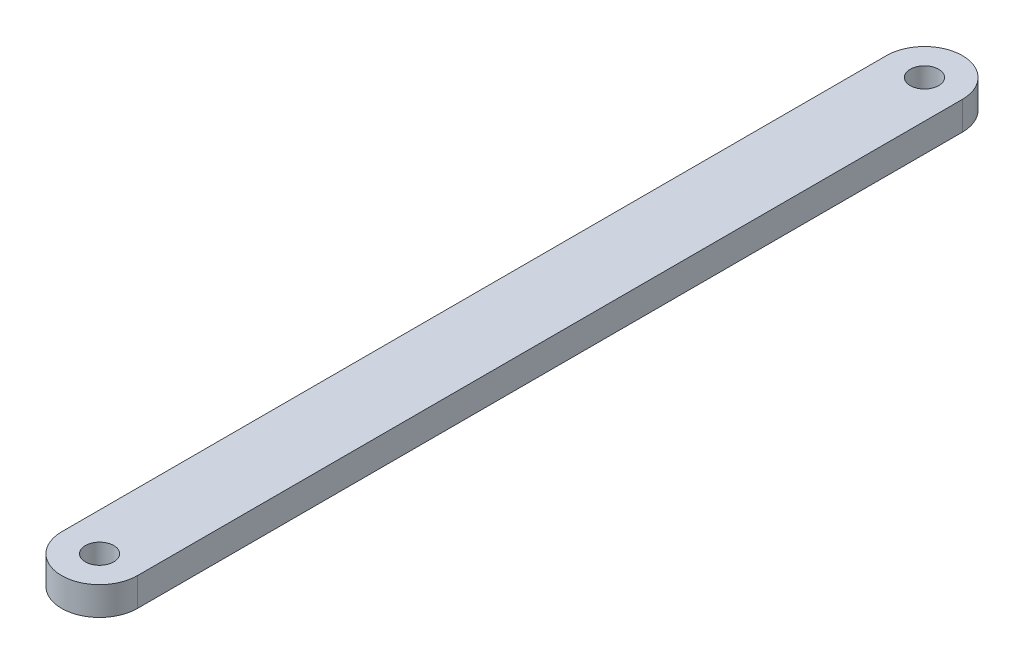
from build123d import *

# Parameters (mm, degrees)
CROQUIS1_R                 = 1.5
SALIENTE_EXTRUIR1_DEPTH    = 3
S_LIDO_MOVER_COPIAR1_ANGLE = 90


with BuildPart() as part:
    # Croquis1 → Saliente-Extruir1 (new body)
    with BuildSketch(Plane.XY):
        with BuildLine():
            Line((41840.173257962, -436.939495492), (41840.173257962, -351.939495492))
            ThreePointArc((41840.173257962, -351.939495492), (41836.173257962, -347.939495492), (41832.173257962, -351.939495492))
            Line((41832.173257962, -351.939495492), (41832.173257962, -436.939495492))
            Line((41832.173257962, -436.939495492), (41832.173257962, -438.939495492))
            ThreePointArc((41832.173257962, -438.939495492), (41836.173257962, -442.939495492), (41840.173257962, -438.939495492))
            Line((41840.173257962, -438.939495492), (41840.173257962, -436.939495492))
        make_face()
        with Locations((41836.173257962, -351.939495492)):
            Circle(CROQUIS1_R, mode=Mode.SUBTRACT)
        with Locations((41836.173257962, -438.939495492)):
            Circle(CROQUIS1_R, mode=Mode.SUBTRACT)
    extrude(amount=SALIENTE_EXTRUIR1_DEPTH)


with BuildPart() as part_1:
    # Sólido-Mover/Copiar1: moved
    add(part.part.rotate(Axis((0, -394.439495492, 1.5), (1, 0, 0)), S_LIDO_MOVER_COPIAR1_ANGLE))


solid = part_1.part
